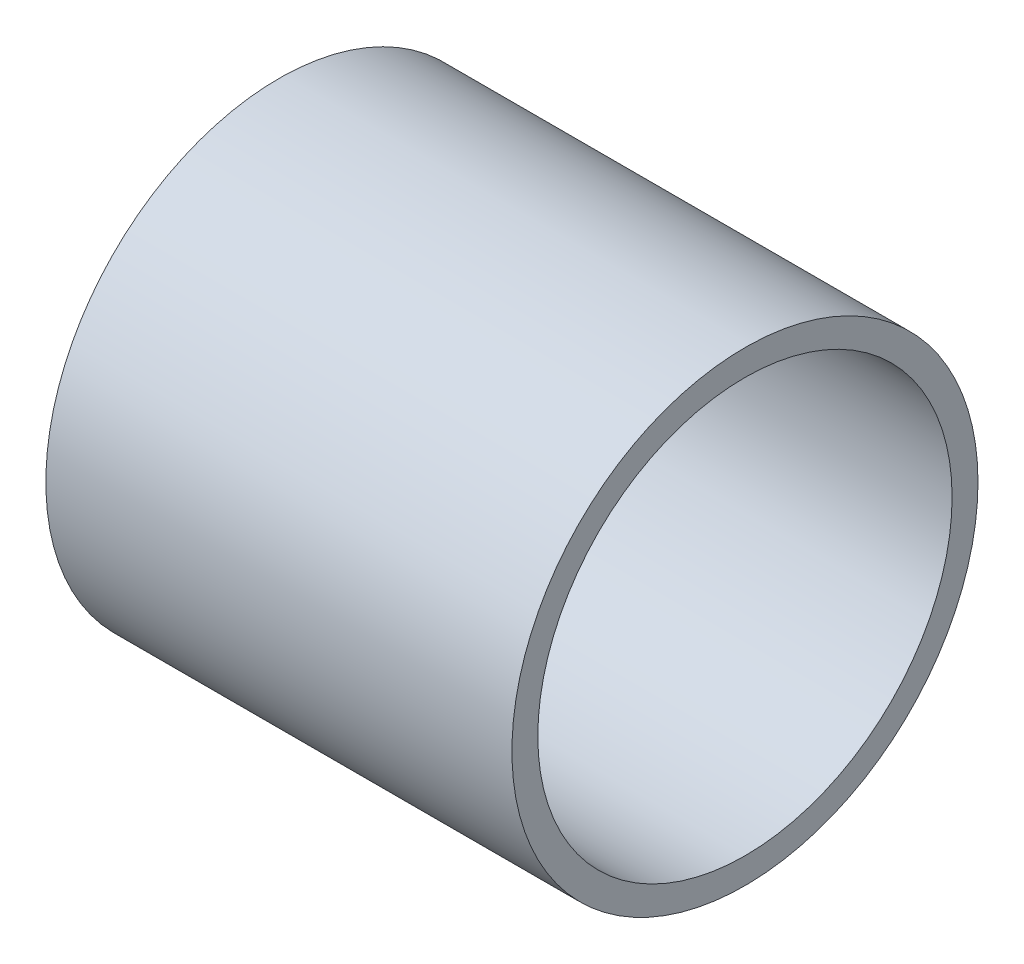
from build123d import *

# Parameters (mm, degrees)
SKETCH1_R               = 4.5
BOSS_EXTRUDE1_DEPTH     = 9
CUT_EXTRUDE1_DEPTH      = 2
CUT_EXTRUDE1_DEPTH_BACK = 12
SKETCH2_R               = 4


with BuildPart() as part:
    # Sketch1 → Boss-Extrude1 (new body)
    with BuildSketch(Plane(origin=(0, 0, 0), x_dir=(0, 0, -1), z_dir=(1, 0, 0))):
        Circle(SKETCH1_R)
    extrude(amount=BOSS_EXTRUDE1_DEPTH)

    # Sketch2 → Cut-Extrude1 (cut, two sides: drawn at the far end of the back side and taken through both)
    with BuildSketch(Plane.ZY.offset(-CUT_EXTRUDE1_DEPTH_BACK)):
        with Locations(Location((0, 0, 0), (0, 0, 180))):
            Circle(SKETCH2_R)
    extrude(amount=CUT_EXTRUDE1_DEPTH + CUT_EXTRUDE1_DEPTH_BACK, mode=Mode.SUBTRACT)


solid = part.part
